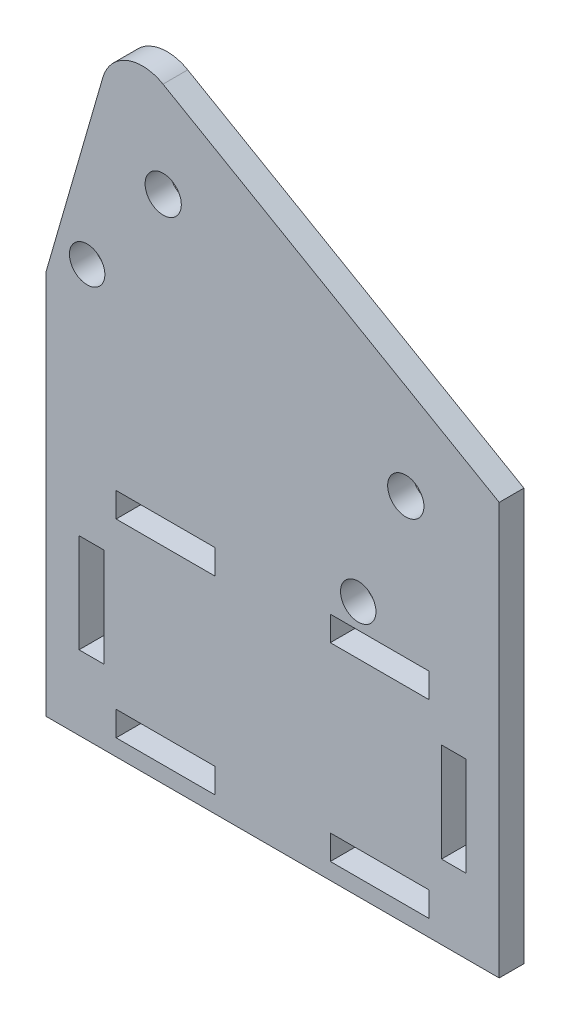
from build123d import *

# Parameters (mm, degrees)
SKETCH_1_W          = 55
SKETCH_1_H          = 30
EXTRUDE_1_DEPTH     = 3
SKETCH_2_W          = 12
SKETCH_2_H          = 3
SKETCH_2_W_2        = 3
SKETCH_2_H_2        = 12
CUT_EXTRUDE_1_DEPTH = 3
SKETCH_3_R          = 2.2
CUT_EXTRUDE_2_DEPTH = 10
CUT_EXTRUDE_3_DEPTH = 10
FILLET_1_R          = 5
SKETCH_5_R          = 2.15
CUT_EXTRUDE_4_DEPTH = 3


with BuildPart() as part:
    # 草图1 → 凸台-拉伸1 (new body)
    with BuildSketch(Plane.XY):
        Polygon((27.5, 35), (-27.5, 66.754264805), (-27.5, 15), (27.5, 15), align=None)
        Rectangle(SKETCH_1_W, SKETCH_1_H)
    extrude(amount=EXTRUDE_1_DEPTH)

    # 草图2 → 切除-拉伸1 (cut)
    with BuildSketch(Plane.XY.offset(3)):
        with Locations((-13, -11.5)):
            Rectangle(SKETCH_2_W, SKETCH_2_H)
        with Locations((13, -11.5)):
            Rectangle(SKETCH_2_W, SKETCH_2_H)
        with Locations((13, 11.5)):
            Rectangle(SKETCH_2_W, SKETCH_2_H)
        with Locations((-13, 11.5)):
            Rectangle(SKETCH_2_W, SKETCH_2_H)
        with Locations((22, 0)):
            Rectangle(SKETCH_2_W_2, SKETCH_2_H_2)
        with Locations((-22, 0)):
            Rectangle(SKETCH_2_W_2, SKETCH_2_H_2)
    extrude(amount=-CUT_EXTRUDE_1_DEPTH, mode=Mode.SUBTRACT)

    # 草图3 → 切除-拉伸2 (cut)
    with BuildSketch(Plane.XY.offset(3)):
        with Locations((-13.284609691, 47)):
            Circle(SKETCH_3_R)
        with Locations((16.160254038, 30)):
            Circle(SKETCH_3_R)
    extrude(amount=-CUT_EXTRUDE_2_DEPTH, mode=Mode.SUBTRACT)

    # 草图4 → 切除-拉伸3 (cut)
    with BuildSketch(Plane.XY.offset(3)):
        Polygon((-18.839745962, 61.754264805), (-27.5, 31.754264805), (-27.5, 66.754264805), align=None)
    extrude(amount=-CUT_EXTRUDE_3_DEPTH, mode=Mode.SUBTRACT)

    # 圆角1
    fillet_1_edges = [part.edges().sort_by_distance(p)[0] for p in [
        (-18.839745962, 61.754264805, 1.5),
    ]]
    fillet(fillet_1_edges, radius=FILLET_1_R)

    # 草图5 → 切除-拉伸4 (cut)
    with BuildSketch(Plane(origin=(0, 0, 0), x_dir=(-1, 0, 0), z_dir=(0, 0, -1))):
        with Locations((-10.392304845, 16.009618943)):
            Circle(SKETCH_5_R)
        with Locations((22.516660498, 35.009618943)):
            Circle(SKETCH_5_R)
    extrude(amount=-CUT_EXTRUDE_4_DEPTH, mode=Mode.SUBTRACT)


solid = part.part
